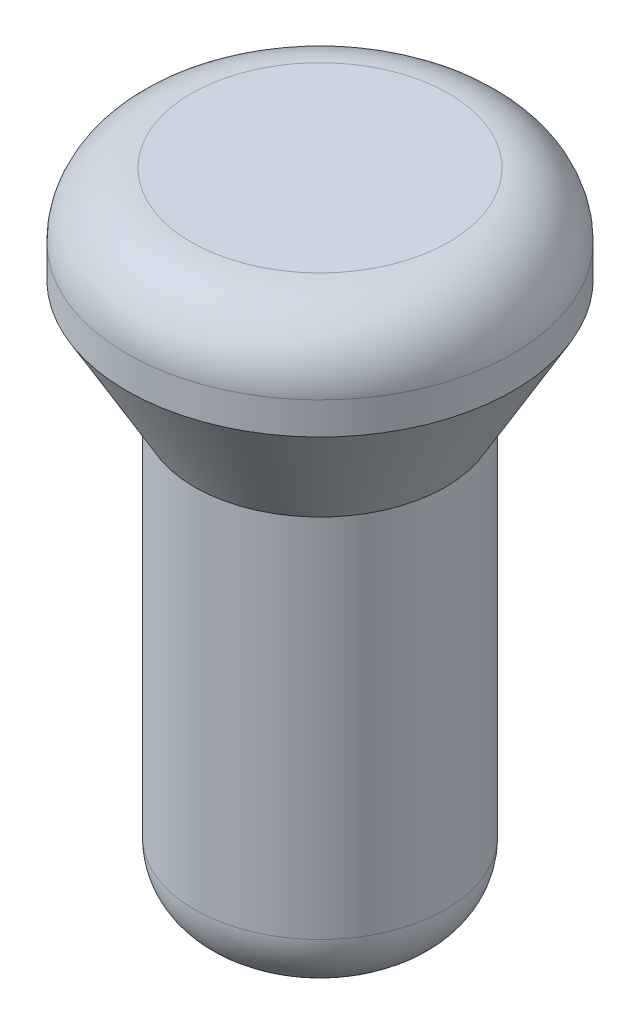
from build123d import *


with BuildPart() as part:
    # Sketch1 → Revolve1 (revolve)
    with BuildSketch(Plane(origin=(0, 0, 0), x_dir=(0, 0, -1), z_dir=(1, 0, 0)), mode=Mode.PRIVATE) as revolve1_sk:
        with BuildLine():
            Line((0, -4.5), (-0.95, -4.5))
            ThreePointArc((-0.95, -4.5), (-1.657106781, -4.207106781), (-1.95, -3.5))
            Line((-1.95, -3.5), (-1.95, 2.181346652))
            Line((-1.95, 2.181346652), (-3, 4))
            Line((-3, 4), (-3, 4.5))
            ThreePointArc((-3, 4.5), (-2.707106781, 5.207106781), (-2, 5.5))
            Line((-2, 5.5), (0, 5.5))
            Line((0, 5.5), (0, -4.5))
        make_face()
    revolve(revolve1_sk.sketch.rotate(Axis((0, 0, 0), (0, 1, 0)), 180), axis=Axis((0, 0, 0), (0, 1, 0)))


solid = part.part
